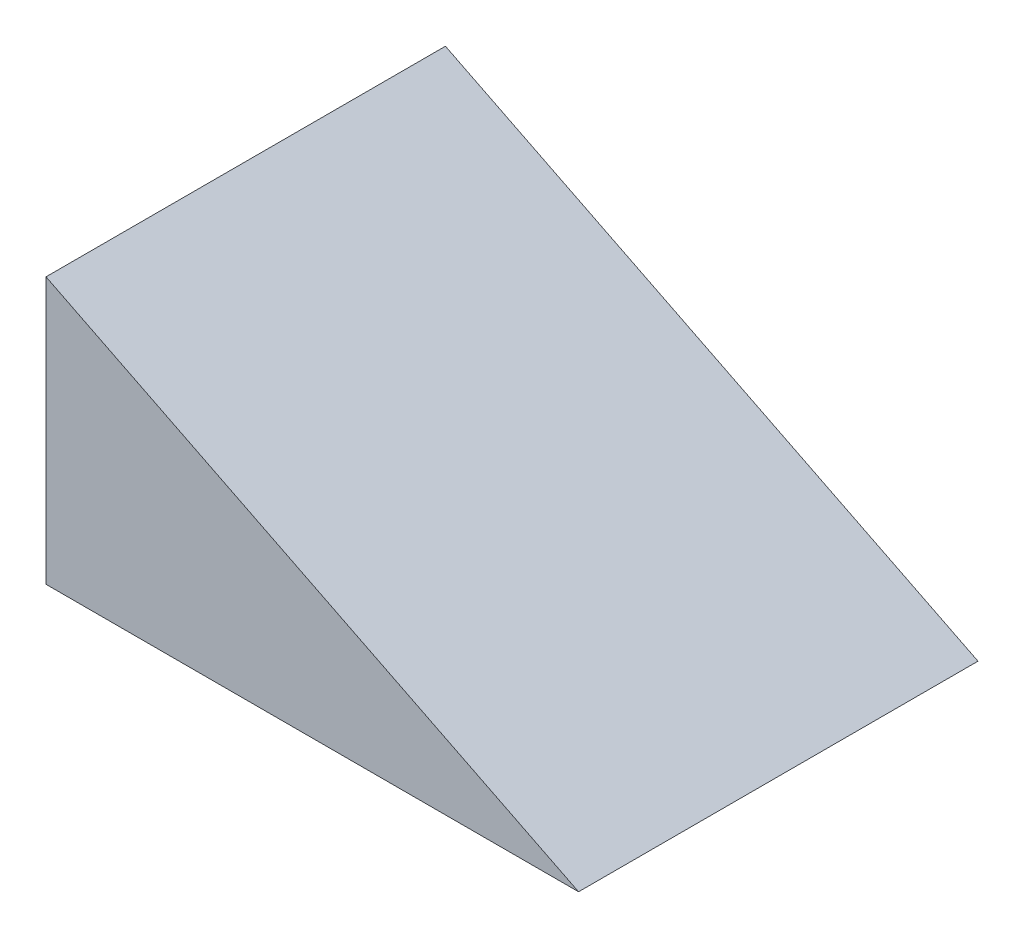
from build123d import *

# Parameters (mm, degrees)
BOSS_EXTRUDE1_DEPTH = 38.1


with BuildPart() as part:
    # Sketch1 → Boss-Extrude1 (new body)
    with BuildSketch(Plane.XY):
        Polygon((0, 0), (0, 25.4), (50.8, 0), align=None)
    extrude(amount=-BOSS_EXTRUDE1_DEPTH)


solid = part.part
